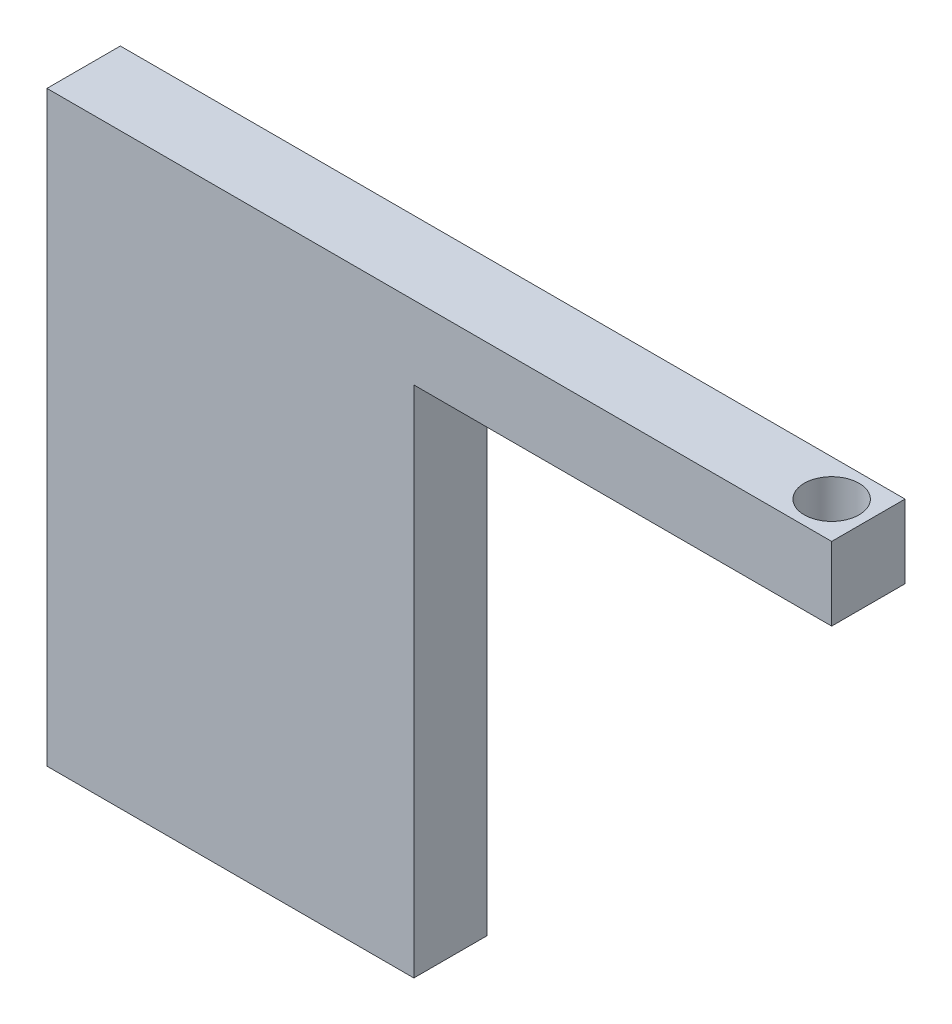
from build123d import *

# Parameters (mm, degrees)
BOSS_EXTRUDE1_DEPTH     = 10
CUT_EXTRUDE1_DEPTH      = 134.663857908
CUT_EXTRUDE1_DEPTH_BACK = 134.663857908
SKETCH2_R               = 3.735264888


with BuildPart() as part:
    # Sketch1 → Boss-Extrude1 (new body)
    with BuildSketch(Plane.XY):
        Polygon((0.330578512, 197.933884298), (0.330578512, 187.933884298), (-56.611570248, 187.933884298), (-56.611570248, 117.933884298), (-106.611570248, 117.933884298), (-106.611570248, 197.933884298), align=None)
    extrude(amount=BOSS_EXTRUDE1_DEPTH)

    # Sketch2 → Cut-Extrude1 (cut, two sides: drawn at the far end of the back side and taken through both)
    with BuildSketch(Plane(origin=(0, 197.933884298, 0), x_dir=(1, 0, 0), z_dir=(0, 1, 0)).offset(-CUT_EXTRUDE1_DEPTH_BACK)):
        with Locations(Location((-4.669421488, -5, 0), (0, 0, 180))):
            Circle(SKETCH2_R)
    extrude(amount=CUT_EXTRUDE1_DEPTH + CUT_EXTRUDE1_DEPTH_BACK, mode=Mode.SUBTRACT)


solid = part.part
